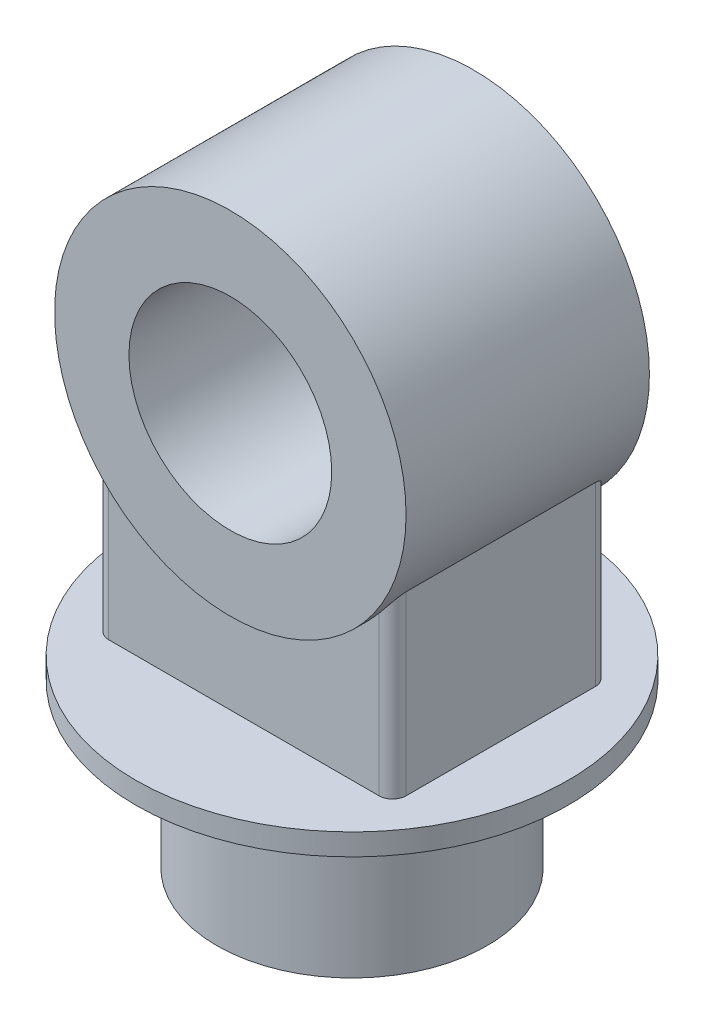
from build123d import *

# Parameters (mm, degrees)
SKETCH5_R                = 100
BOSS_EXTRUDE1_DEPTH      = 120
SKETCH6_R                = 160
BOSS_EXTRUDE2_DEPTH      = 16
SKETCH7_R                = 130
SKETCH7_R_2              = 75
BOSS_EXTRUDE3_DEPTH      = 90
BOSS_EXTRUDE4_REACH      = 402.125
BOSS_EXTRUDE4_END_RADIUS = 130
SKETCH8_W                = 220
SKETCH8_H                = 160
FILLET1_R                = 10
FILLET2_R                = 10


with BuildPart() as part:
    # Sketch5 → Boss-Extrude1 (new body)
    with BuildSketch(Plane(origin=(0, 0, 0), x_dir=(1, 0, 0), z_dir=(0, 1, 0))):
        with Locations(Location((0, 0, 0), (0, 0, 270))):
            Circle(SKETCH5_R)
    extrude(amount=BOSS_EXTRUDE1_DEPTH)

    # Sketch6 → Boss-Extrude2 (add)
    with BuildSketch(Plane(origin=(0, 120, 0), x_dir=(1, 0, 0), z_dir=(0, 1, 0))):
        with Locations(Location((0, 0, 0), (0, 0, 270))):
            Circle(SKETCH6_R)
    extrude(amount=BOSS_EXTRUDE2_DEPTH)



with BuildPart() as body_2:
    # Sketch7 → Boss-Extrude3 (new, symmetric)
    with BuildSketch(Plane.XY):
        with Locations(Location((0, 336, 0), (0, 0, 180))):
            Circle(SKETCH7_R)
        with Locations(Location((0, 336, 0), (0, 0, 180))):
            Circle(SKETCH7_R_2, mode=Mode.SUBTRACT)
    extrude(amount=BOSS_EXTRUDE3_DEPTH, both=True)


with BuildPart() as part_1:
    add(part.part)

    add(body_2.part)  # Boss-Extrude4 merges body 2
    # Boss-Extrude4: up to this cylinder (the profile starts outside it)
    boss_extrude4_end = Plane(origin=(0, 336, 0), z_dir=(0, 0, -1)) * Cylinder(BOSS_EXTRUDE4_END_RADIUS, 1065.25, mode=Mode.PRIVATE)
    # Sketch8 → Boss-Extrude4 (add, up to the surface)
    with BuildSketch(Plane(origin=(0, 136, 0), x_dir=(1, 0, 0), z_dir=(0, 1, 0)), mode=Mode.PRIVATE) as boss_extrude4_sk1:
        Rectangle(SKETCH8_W, SKETCH8_H)
    boss_extrude4_tool1 = extrude(boss_extrude4_sk1.sketch, amount=BOSS_EXTRUDE4_REACH, mode=Mode.PRIVATE) - boss_extrude4_end
    add(boss_extrude4_tool1.solids().sort_by_distance((0, 136, 0))[0])

    # Fillet1
    fillet1_edges = [part_1.edges().sort_by_distance(p)[0] for p in [
        (-110, 201.358983849, 80),
        (110, 201.358983849, 80),
    ]]
    fillet(fillet1_edges, radius=FILLET1_R)

    # Fillet2
    fillet2_edges = [part_1.edges().sort_by_distance(p)[0] for p in [
        (-110, 201.358983849, -80),
        (110, 201.358983849, -80),
    ]]
    fillet(fillet2_edges, radius=FILLET2_R)


solid = part_1.part
